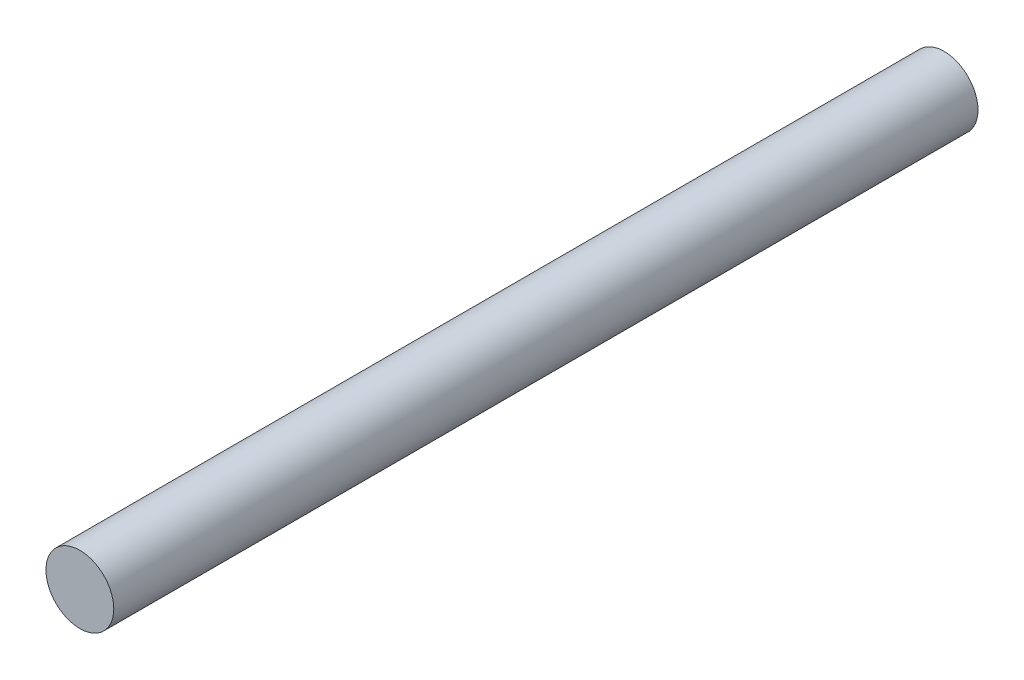
from build123d import *

# Parameters (mm, degrees)
AXLE_DEPTH      = 25.4
AXLE_DEPTH_BACK = 25.4
SKETCH1_R       = 1.9939


with BuildPart() as part:
    # Sketch1 → Axle (new, two sides: drawn at the far end of the back side and taken through both)
    with BuildSketch(Plane.XY.offset(-AXLE_DEPTH_BACK)):
        Circle(SKETCH1_R)
    extrude(amount=AXLE_DEPTH + AXLE_DEPTH_BACK)


solid = part.part
